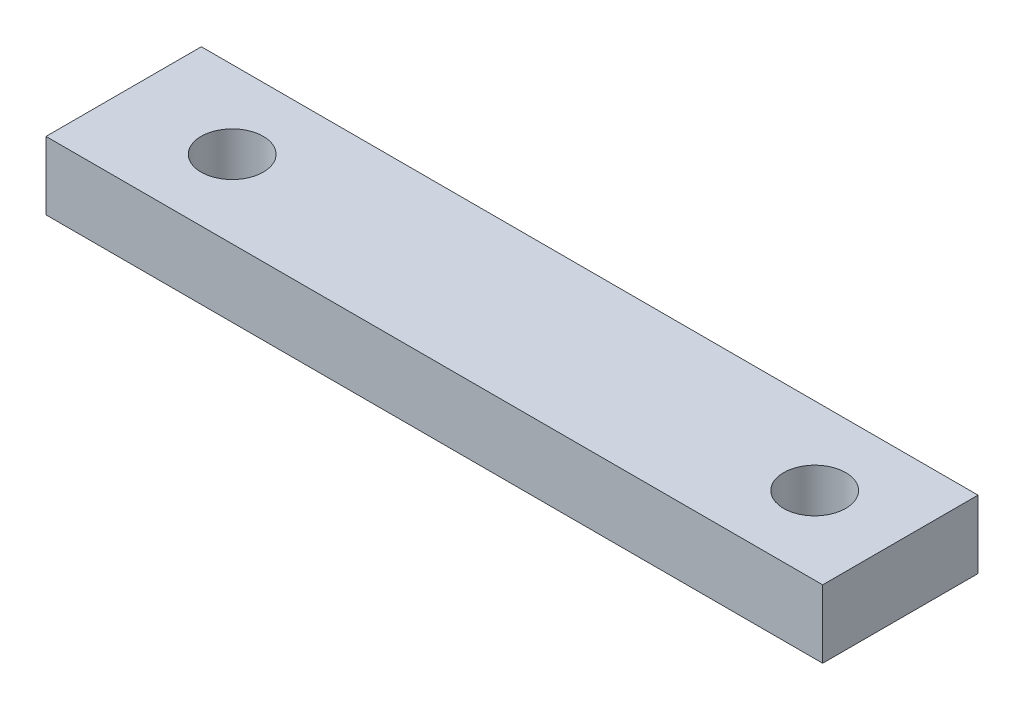
from build123d import *

# Parameters (mm, degrees)
SKETCH_1_W          = 40
SKETCH_1_H          = 8
EXTRUDE_2_DEPTH     = 3.5
SKETCH_4_R          = 1.6
CUT_EXTRUDE_1_DEPTH = 3.5


with BuildPart() as part:
    # 草图1 → 凸台-拉伸2 (new body)
    with BuildSketch(Plane(origin=(0, 0, 0), x_dir=(1, 0, 0), z_dir=(0, 1, 0))):
        Rectangle(SKETCH_1_W, SKETCH_1_H)
    extrude(amount=EXTRUDE_2_DEPTH)

    # 草图4 → 切除-拉伸1 (cut)
    with BuildSketch(Plane.XZ):
        with Locations(Location((-14.410766084, 0, 0), (0, 0, 270))):
            Circle(SKETCH_4_R)
        with Locations(Location((15.589233916, 0, 0), (0, 0, 270))):
            Circle(SKETCH_4_R)
    extrude(amount=-CUT_EXTRUDE_1_DEPTH, mode=Mode.SUBTRACT)


solid = part.part
